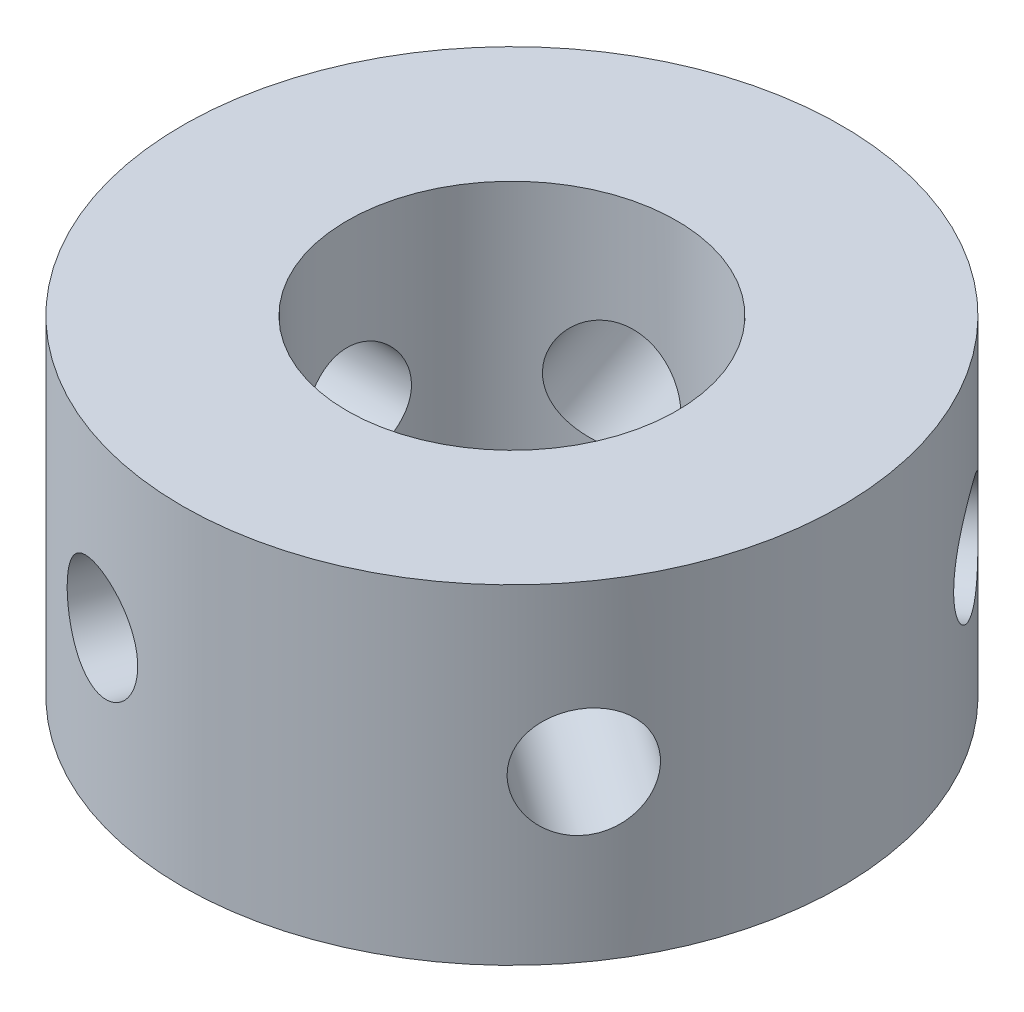
from build123d import *

# Parameters (mm, degrees)
SKETCH1_R           = 3
SKETCH1_R_2         = 1.5
BOSS_EXTRUDE1_DEPTH = 3
CUT_EXTRUDE1_DEPTH  = 3
CIRPATTERN1_COUNT   = 5


with BuildPart() as part:
    # Sketch1 → Boss-Extrude1 (new body)
    with BuildSketch(Plane(origin=(0, 0, 0), x_dir=(1, 0, 0), z_dir=(0, 1, 0))):
        with Locations(Location((0, 0, 0), (0, 0, 270))):
            Circle(SKETCH1_R)
        with Locations(Location((0, 0, 0), (0, 0, 270))):
            Circle(SKETCH1_R_2, mode=Mode.SUBTRACT)
    extrude(amount=BOSS_EXTRUDE1_DEPTH)

    # Sketch2 → Cut-Extrude1 (cut)
    with BuildSketch(Plane(origin=(0, 0, 0), x_dir=(0, 0, -1), z_dir=(1, 0, 0))):
        with BuildLine():
            ThreePointArc((0, 2), (-0.5, 1.5), (0, 1))
            Line((0, 1), (0, 2))
        make_face()
        with BuildLine():
            Line((0, 2), (0, 1))
            ThreePointArc((0, 1), (0.353553391, 1.146446609), (0.5, 1.5))
            ThreePointArc((0.5, 1.5), (0.353553391, 1.853553391), (0, 2))
        make_face()
    cut_extrude1 = extrude(amount=-CUT_EXTRUDE1_DEPTH, mode=Mode.SUBTRACT)

    # CirPattern1: Cut-Extrude1 ×5 about axis
    cirpattern1_axis = Axis((0, 0, 0), (0, 1, 0))
    for i in range(1, CIRPATTERN1_COUNT):
        add(cut_extrude1.rotate(cirpattern1_axis, i * 360 / CIRPATTERN1_COUNT), mode=Mode.SUBTRACT)


solid = part.part
